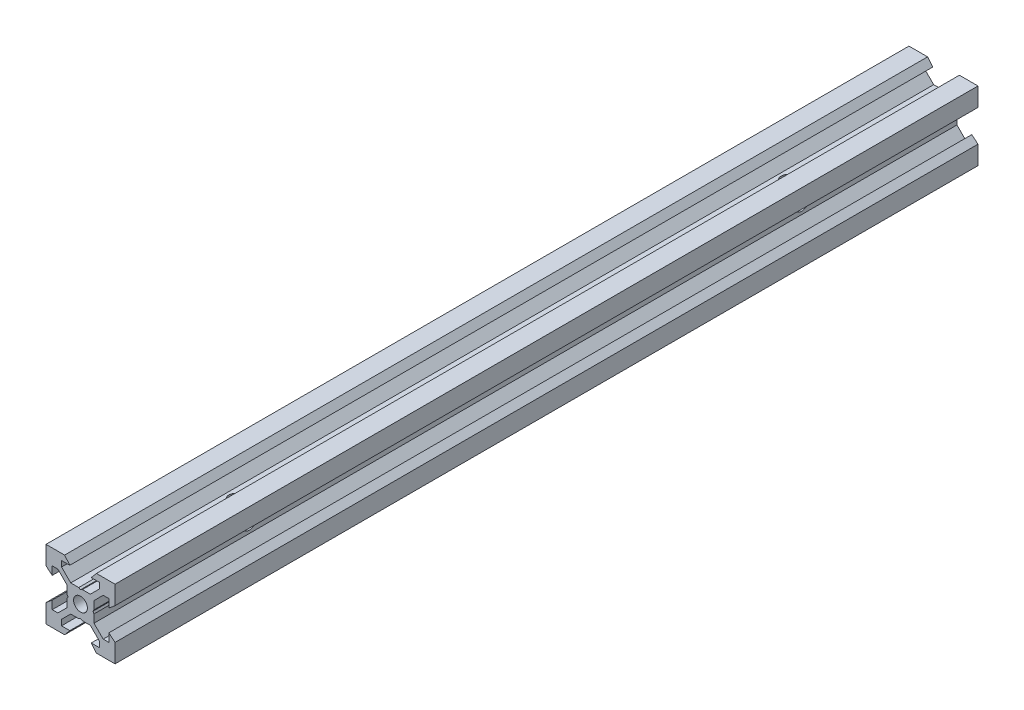
from build123d import *

# Parameters (mm, degrees)
SKETCH1_R               = 2
BOSS_EXTRUDE1_DEPTH     = 250
CUT_EXTRUDE1_DEPTH      = 251.585733832
CUT_EXTRUDE1_DEPTH_BACK = 251.585733832
SKETCH2_R               = 2
CUT_EXTRUDE2_DEPTH      = 251.585733832
CUT_EXTRUDE2_DEPTH_BACK = 251.585733832
SKETCH3_R               = 2


with BuildPart() as part:
    # Sketch1 → Boss-Extrude1 (new body)
    with BuildSketch(Plane.XY):
        Polygon((10, 10), (10, 4.610379336), (8.2, 3.1), (8.2, 5.5), (6.560660172, 5.5), (3.9, 2.839339828), (3.9, 0.519615242), (3.6, 0), (3.9, -0.519615242), (3.9, -2.839339828), (6.560660172, -5.5), (8.2, -5.5), (8.2, -3.1), (10, -4.610379336), (10, -10), (4.610379336, -10), (3.1, -8.2), (5.5, -8.2), (5.5, -6.560660172), (2.839339828, -3.9), (0.519615242, -3.9), (0, -3.6), (-0.519615242, -3.9), (-2.839339828, -3.9), (-5.5, -6.560660172), (-5.5, -8.2), (-3.1, -8.2), (-4.610379336, -10), (-10, -10), (-10, -4.610379336), (-8.2, -3.1), (-8.2, -5.5), (-6.560660172, -5.5), (-3.9, -2.839339828), (-3.9, -0.519615242), (-3.6, 0), (-3.9, 0.519615242), (-3.9, 2.839339828), (-6.560660172, 5.5), (-8.2, 5.5), (-8.2, 3.1), (-10, 4.610379336), (-10, 10), (-4.610379336, 10), (-3.1, 8.2), (-5.5, 8.2), (-5.5, 6.560660172), (-2.839339828, 3.9), (-0.519615242, 3.9), (0, 3.6), (0.519615242, 3.9), (2.839339828, 3.9), (5.5, 6.560660172), (5.5, 8.2), (3.1, 8.2), (4.610379336, 10), align=None)
        Circle(SKETCH1_R, mode=Mode.SUBTRACT)
    extrude(amount=BOSS_EXTRUDE1_DEPTH)

    # Sketch2 → Cut-Extrude1 (cut, two sides: drawn at the far end of the back side and taken through both)
    with BuildSketch(Plane(origin=(0, -3.9, 0), x_dir=(-1, 0, 0), z_dir=(0, -1, 0)).offset(-CUT_EXTRUDE1_DEPTH_BACK)):
        with Locations(Location((0, -205, 0), (0, 0, 90))):
            Circle(SKETCH2_R)
        with Locations(Location((0, -45, 0), (0, 0, 90))):
            Circle(SKETCH2_R)
    extrude(amount=CUT_EXTRUDE1_DEPTH + CUT_EXTRUDE1_DEPTH_BACK, mode=Mode.SUBTRACT)

    # Sketch3 → Cut-Extrude2 (cut, two sides: drawn at the far end of the back side and taken through both)
    with BuildSketch(Plane(origin=(3.9, 0, 0), x_dir=(0, 0, -1), z_dir=(1, 0, 0)).offset(-CUT_EXTRUDE2_DEPTH_BACK)):
        with Locations(Location((-45, 0, 0), (0, 0, 45))):
            Circle(SKETCH3_R)
        with Locations(Location((-205, 0, 0), (0, 0, 45))):
            Circle(SKETCH3_R)
    extrude(amount=CUT_EXTRUDE2_DEPTH + CUT_EXTRUDE2_DEPTH_BACK, mode=Mode.SUBTRACT)


solid = part.part
